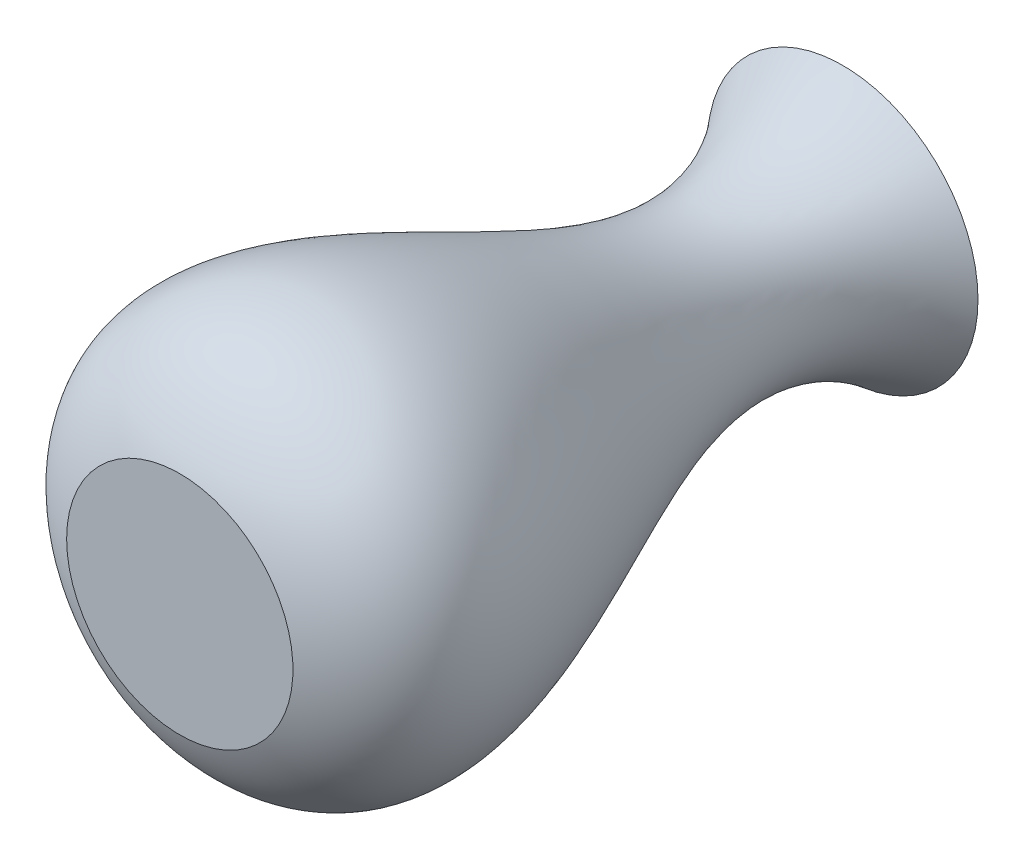
from build123d import *

# Parameters (mm, degrees)
SHELL1_T = -0.254


with BuildPart() as part:
    # Sketch1 → Revolve1 (revolve)
    with BuildSketch(Plane(origin=(0, 0, 0), x_dir=(1, 0, 0), z_dir=(0, 1, 0))):
        with BuildLine():
            Line((0, 0), (23.936447545, 0))
            Line((23.936447545, 0), (23.936447545, 140.231321219))
            Line((23.936447545, 140.231321219), (-4.668988235, 140.231321219))
            add(Edge.make_bspline(
                [(0, 0), (-31.587344777, 12.767437785), (-4.305471737, 72.718999581), (14.911739428, 116.99221523), (-4.668988235, 140.231321219)],
                knots=[0, 0, 0, 0, 0.522405429, 1, 1, 1, 1], degree=3))
        make_face()
    revolve(axis=Axis((23.936447545, 0, -140.231321219), (0, 0, 1)))

    # Shell1
    shell1_openings = [part.faces().sort_by_distance(p)[0] for p in [
        (23.936447545, 0, -140.231321219),
    ]]
    offset(amount=SHELL1_T, openings=shell1_openings, kind=Kind.INTERSECTION)


solid = part.part
